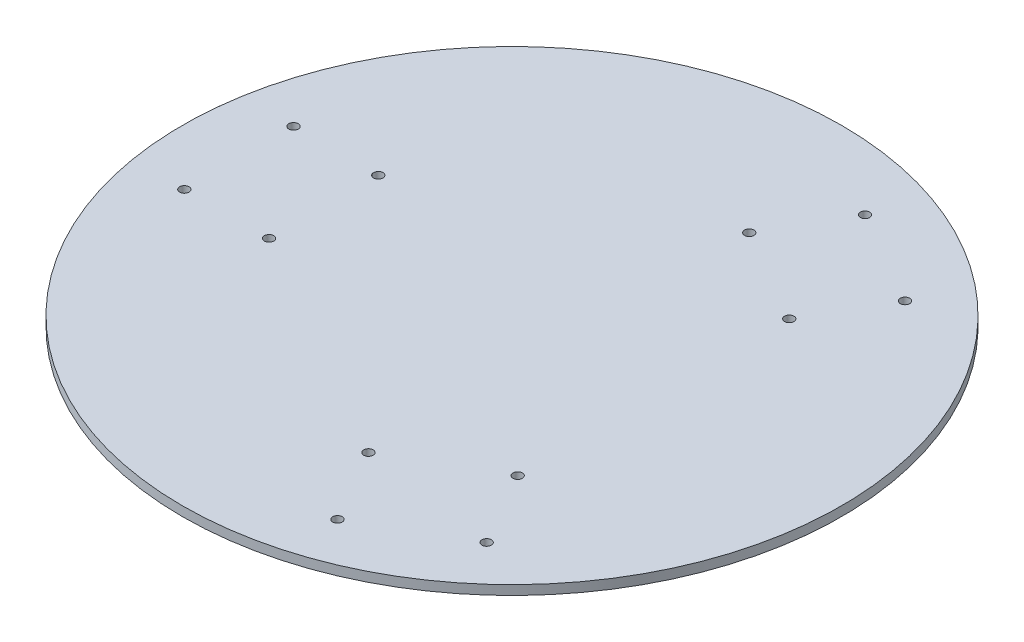
from build123d import *

# Parameters (mm, degrees)
SKETCH_1_R          = 175
EXTRUDE_1_DEPTH     = 5
SKETCH_2_R          = 2.5
CUT_EXTRUDE_1_DEPTH = 248.53787589


with BuildPart() as part:
    # 草图1 → 凸台-拉伸1 (new body)
    with BuildSketch(Plane(origin=(0, 0, 0), x_dir=(1, 0, 0), z_dir=(0, 1, 0))):
        Circle(SKETCH_1_R)
    extrude(amount=EXTRUDE_1_DEPTH)

    # 草图2 → 切除-拉伸1 (cut, through all)
    with BuildSketch(Plane(origin=(0, 5, 0), x_dir=(1, 0, 0), z_dir=(0, 1, 0))):
        with Locations((-145, -29)):
            Circle(SKETCH_2_R)
        with Locations((-145, 29)):
            Circle(SKETCH_2_R)
        with Locations((-100, -29)):
            Circle(SKETCH_2_R)
        with Locations((-100, 29)):
            Circle(SKETCH_2_R)
        with Locations((47.38526329, 140.073683549)):
            Circle(SKETCH_2_R)
        with Locations((97.61473671, 111.073683549)):
            Circle(SKETCH_2_R)
        with Locations((24.88526329, 101.102540378)):
            Circle(SKETCH_2_R)
        with Locations((75.11473671, 72.102540378)):
            Circle(SKETCH_2_R)
        with Locations((97.61473671, -111.073683549)):
            Circle(SKETCH_2_R)
        with Locations((47.38526329, -140.073683549)):
            Circle(SKETCH_2_R)
        with Locations((75.11473671, -72.102540378)):
            Circle(SKETCH_2_R)
        with Locations((24.88526329, -101.102540378)):
            Circle(SKETCH_2_R)
    extrude(amount=-CUT_EXTRUDE_1_DEPTH, mode=Mode.SUBTRACT)


solid = part.part
